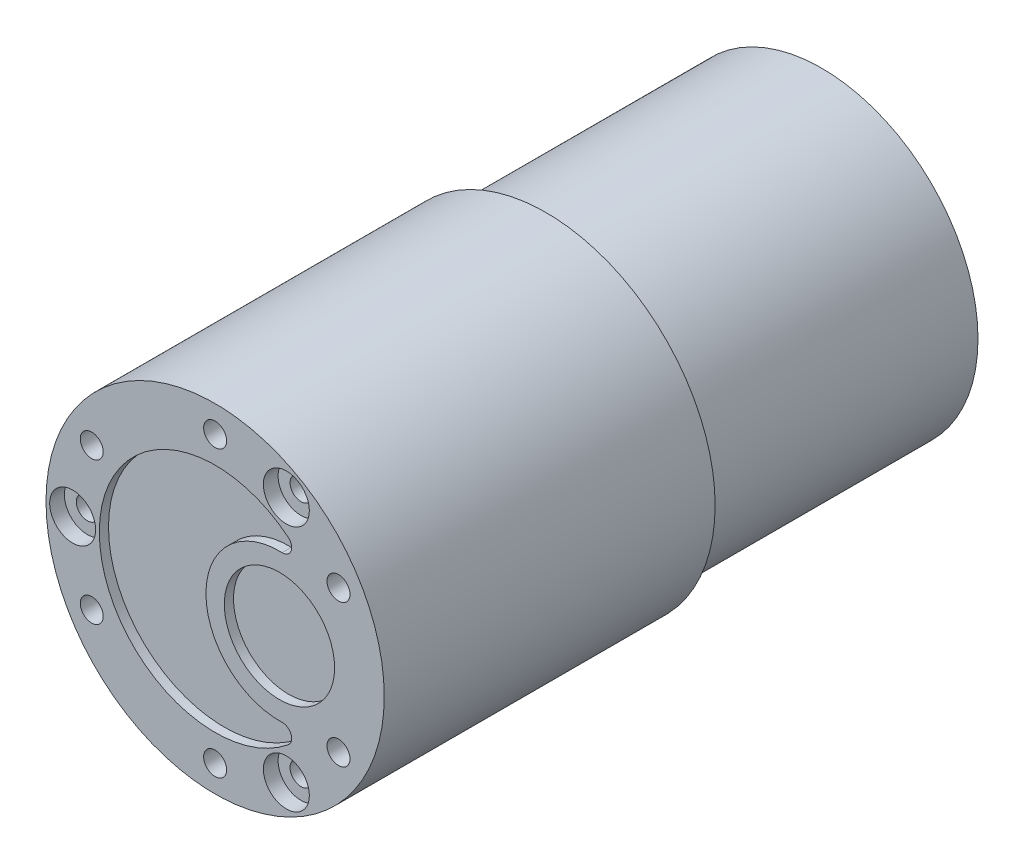
from build123d import *

# Parameters (mm, degrees)
TALADRO_ROSCADO_M3X0_52_D                            = 2.5
TALADRO_ROSCADO_M3X0_52_DEPTH                        = 8.5
TALADRO_ROSCADO_M3X0_52_TIP                          = 0.751075774
REFRENTADO_PARA_TORNILLO_CON_CABEZA_TRON_D           = 2.4
REFRENTADO_PARA_TORNILLO_CON_CABEZA_TRON_DEPTH       = 5
REFRENTADO_PARA_TORNILLO_CON_CABEZA_TRON_CBORE_D     = 5
REFRENTADO_PARA_TORNILLO_CON_CABEZA_TRON_CBORE_DEPTH = 1.6
REFRENTADO_PARA_TORNILLO_CON_CABEZA_TRON_TIP         = 0.721032743
CROQUIS8_R                                           = 6
CORTAR_EXTRUIR2_DEPTH                                = 1


with BuildPart() as part:
    # Croquis1 → Revolución1 (revolve)
    with BuildSketch(Plane(origin=(0, 0, 0), x_dir=(0, 0, -1), z_dir=(1, 0, 0)), mode=Mode.PRIVATE) as revoluci_n1_sk:
        Polygon((-33.5, 0), (33.5, 0), (33.5, 5), (32.5, 6), (32.5, 17), (2.5, 17), (2.5, 18.4), (-33.5, 18.4), align=None)
    revolve(revoluci_n1_sk.sketch.rotate(Axis((0, 0, 33.5), (0, 0, -1)), 90), axis=Axis((0, 0, 33.5), (0, 0, -1)))

    # Taladro roscado M3x0.52
    with Locations(Plane.XY.offset(33.5)):
        with Locations((0, 15.5), (0, -15.5), (13.423393759, -7.75), (13.423393759, 7.75), (-13.423393759, 7.75), (-13.423393759, -7.75)):
            Hole(TALADRO_ROSCADO_M3X0_52_D / 2, depth=TALADRO_ROSCADO_M3X0_52_DEPTH)
            with Locations((0, 0, -(TALADRO_ROSCADO_M3X0_52_DEPTH + TALADRO_ROSCADO_M3X0_52_TIP / 2))):  # 118° drill point
                Cone(0, TALADRO_ROSCADO_M3X0_52_D / 2, TALADRO_ROSCADO_M3X0_52_TIP, mode=Mode.SUBTRACT)

    # Refrentado para tornillo con cabeza troncocónica de M21
    with Locations(Plane.XY.offset(33.5)):
        with Locations((-15.5, 0), (7.75, 13.423393759), (7.75, -13.423393759)):
            CounterBoreHole(REFRENTADO_PARA_TORNILLO_CON_CABEZA_TRON_D / 2, REFRENTADO_PARA_TORNILLO_CON_CABEZA_TRON_CBORE_D / 2, REFRENTADO_PARA_TORNILLO_CON_CABEZA_TRON_CBORE_DEPTH, depth=REFRENTADO_PARA_TORNILLO_CON_CABEZA_TRON_DEPTH)
            with Locations((0, 0, -(REFRENTADO_PARA_TORNILLO_CON_CABEZA_TRON_DEPTH + REFRENTADO_PARA_TORNILLO_CON_CABEZA_TRON_TIP / 2))):  # 118° drill point
                Cone(0, REFRENTADO_PARA_TORNILLO_CON_CABEZA_TRON_D / 2, REFRENTADO_PARA_TORNILLO_CON_CABEZA_TRON_TIP, mode=Mode.SUBTRACT)

    # Croquis8 → Cortar-Extruir2 (cut)
    with BuildSketch(Plane.XY.offset(33.5)):
        with Locations((7, 0)):
            Circle(CROQUIS8_R)
        with BuildLine():
            ThreePointArc((7.957241379, 9.769458001), (-12.6, 0), (7.957241379, -9.769458001))
            ThreePointArc((7.957241379, -9.769458001), (8.261660496, -8.641961193), (7.28952381, -7.994759281))
            ThreePointArc((7.28952381, -7.994759281), (-1, 0), (7.28952381, 7.994759281))
            ThreePointArc((7.28952381, 7.994759281), (8.261660496, 8.641961193), (7.957241379, 9.769458001))
        make_face()
    extrude(amount=-CORTAR_EXTRUIR2_DEPTH, mode=Mode.SUBTRACT)


solid = part.part
